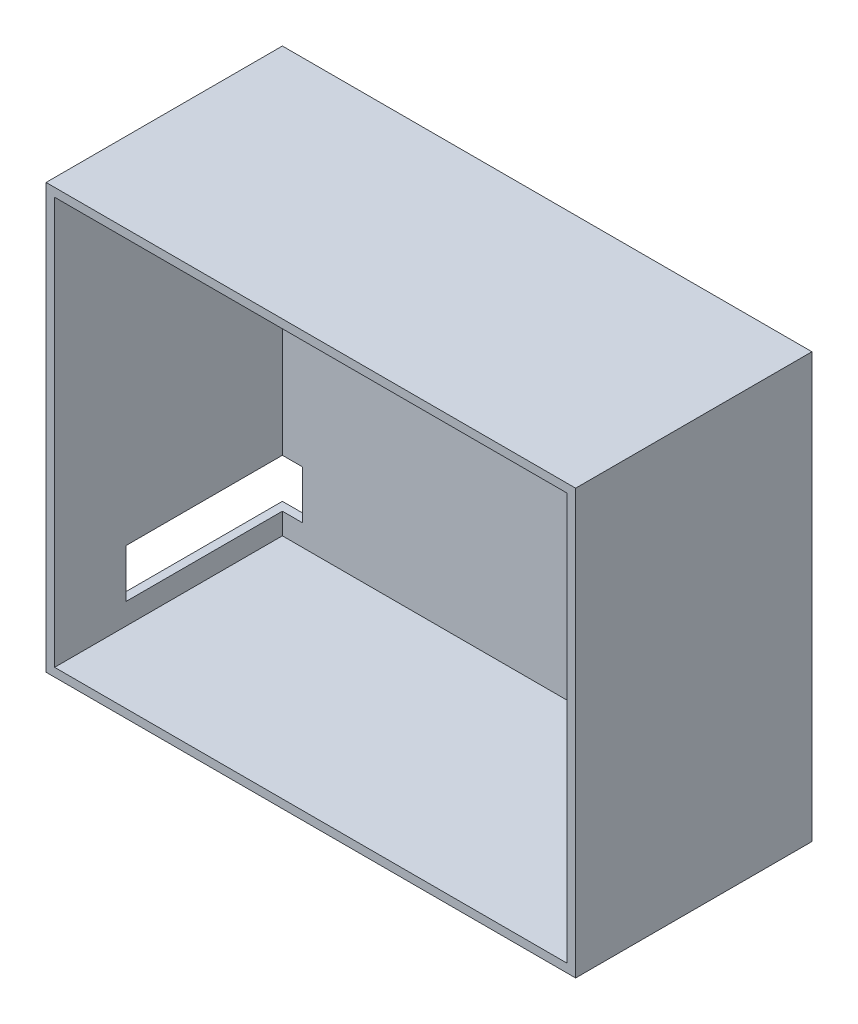
from build123d import *

# Parameters (mm, degrees)
SKETCH_1_W                      = 186
SKETCH_1_H                      = 149
FLOOR_T3_DEPTH                  = 3
SKETCH_2_W                      = 186
SKETCH_2_H                      = 149
SKETCH_2_W_2                    = 180
SKETCH_2_H_2                    = 143
WALLS_T3_DEPTH80_DEPTH          = 83
SKETCH_3_W                      = 11
SKETCH_3_H                      = 8
SERVO_STAND_RELIEF_W8_H58_DEPTH = 58
SKETCH_4_W                      = 11
SKETCH_4_H                      = 17
SERVO_EARS_RELIEF_V3_DEPTH      = 58


with BuildPart() as part:
    # 草图1 → Floor_T3 (new body)
    with BuildSketch(Plane.XY):
        with Locations((93, 74.5)):
            Rectangle(SKETCH_1_W, SKETCH_1_H)
    extrude(amount=FLOOR_T3_DEPTH)

    # 草图2 → Walls_T3_depth80 (add)
    with BuildSketch(Plane.XY):
        with Locations((93, 74.5)):
            Rectangle(SKETCH_2_W, SKETCH_2_H)
        with Locations((93, 74.5)):
            Rectangle(SKETCH_2_W_2, SKETCH_2_H_2, mode=Mode.SUBTRACT)
    extrude(amount=WALLS_T3_DEPTH80_DEPTH)

    # 草图3 → Servo_stand_relief_W8_H58 (cut)
    with BuildSketch(Plane.XY):
        with Locations((4.5, 23.5)):
            Rectangle(SKETCH_3_W, SKETCH_3_H)
    extrude(amount=SERVO_STAND_RELIEF_W8_H58_DEPTH, mode=Mode.SUBTRACT)

    # 草图4 → Servo_ears_relief_v3 (cut)
    with BuildSketch(Plane.XY):
        with Locations((4.5, 19)):
            Rectangle(SKETCH_4_W, SKETCH_4_H)
    extrude(amount=SERVO_EARS_RELIEF_V3_DEPTH, mode=Mode.SUBTRACT)


solid = part.part
